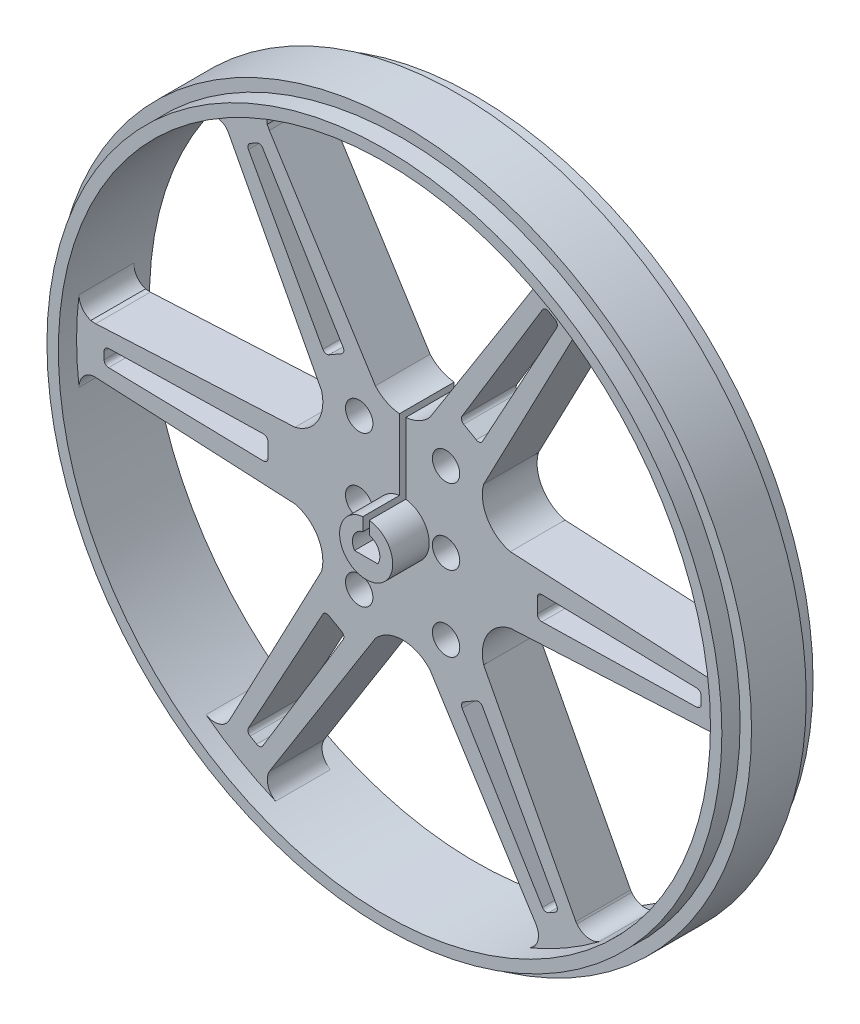
from build123d import *

# Parameters (mm, degrees)
Y_KSEKLIK_EKSTR_ZYON5_DEPTH      = 5
Y_KSEKLIK_EKSTR_ZYON5_DEPTH_BACK = 5
IZIM1_R                          = 37
IZIM1_R_2                        = 35.75
Y_KSEKLIK_EKSTR_ZYON6_DEPTH      = 3
Y_KSEKLIK_EKSTR_ZYON6_DEPTH_BACK = 3
IZIM1_13_R                       = 38.25
IZIM1_13_R_2                     = 37
Y_KSEKLIK_EKSTR_ZYON7_DEPTH      = 3
Y_KSEKLIK_EKSTR_ZYON7_DEPTH_BACK = 3
IZIM1_14_R                       = 1.5
Y_KSEKLIK_EKSTR_ZYON8_DEPTH      = 7
Y_KSEKLIK_EKSTR_ZYON8_DEPTH_BACK = 3


with BuildPart() as part:
    # Çizim1 → Yükseklik-Ekstrüzyon5 (new, two sides: drawn at the far end of the back side and taken through both)
    with BuildSketch(Plane.XY.offset(-Y_KSEKLIK_EKSTR_ZYON5_DEPTH_BACK)):
        Circle(IZIM1_R)
        Circle(IZIM1_R_2, mode=Mode.SUBTRACT)
    extrude(amount=Y_KSEKLIK_EKSTR_ZYON5_DEPTH + Y_KSEKLIK_EKSTR_ZYON5_DEPTH_BACK)

    # Çizim1<13> → Yükseklik-Ekstrüzyon6 (add, two sides: drawn at the far end of the back side and taken through both)
    with BuildSketch(Plane.XY.offset(-Y_KSEKLIK_EKSTR_ZYON6_DEPTH_BACK)):
        Circle(IZIM1_13_R)
        Circle(IZIM1_13_R_2, mode=Mode.SUBTRACT)
    extrude(amount=Y_KSEKLIK_EKSTR_ZYON6_DEPTH + Y_KSEKLIK_EKSTR_ZYON6_DEPTH_BACK)

    # Çizim1<14> → Yükseklik-Ekstrüzyon7 (add, two sides: drawn at the far end of the back side and taken through both)
    with BuildSketch(Plane.XY.offset(-Y_KSEKLIK_EKSTR_ZYON7_DEPTH_BACK)):
        with BuildLine():
            Line((0.352105211, 10.658426892), (0.352105211, 8.25))
            Line((0.352105211, 8.25), (0.352105211, 2.891667151))
            ThreePointArc((0.352105211, 2.891667151), (2.180757714, 1.931324101), (2.913025402, 0))
            ThreePointArc((2.913025402, 0), (-1.931880518, -2.180264813), (-0.350629391, 2.891846473))
            Line((-0.350629391, 2.891846473), (-0.347894744, 8.250178624))
            Line((-0.347894744, 8.250178624), (-0.346665593, 10.658605202))
            ThreePointArc((-0.346665593, 10.658605202), (-1.792646187, 11.069293289), (-2.984941087, 11.98469345))
            Line((-2.984941087, 11.98469345), (-14.607887345, 30.4259885))
            Line((-14.607887345, 30.4259885), (-14.847868654, 30.886461313))
            ThreePointArc((-14.847868654, 30.886461313), (-14.727142284, 32.060689053), (-13.92488883, 32.926584565))
            ThreePointArc((-13.92488883, 32.926584565), (-17.875, 30.960408185), (-21.552814278, 28.522599754))
            ThreePointArc((-21.552814278, 28.522599754), (-20.401800041, 28.78442387), (-19.324525803, 28.301862102))
            Line((-19.324525803, 28.301862102), (-19.045735303, 27.863795787))
            Line((-19.045735303, 27.863795787), (-8.886868167, 8.577081355))
            ThreePointArc((-8.886868167, 8.577081355), (-9.303777514, 5.496482546), (-11.800782256, 3.644761794))
            Line((-11.800782256, 3.644761794), (-33.653555768, 2.549643924))
            Line((-33.653555768, 2.549643924), (-34.19029782, 2.590308308))
            ThreePointArc((-34.19029782, 2.590308308), (-35.134400226, 3.283913251), (-35.477703108, 4.403984811))
            ThreePointArc((-35.477703108, 4.403984811), (-35.75, 0), (-35.477703108, -4.403984811))
            ThreePointArc((-35.477703108, -4.403984811), (-35.134400226, -3.283913251), (-34.19029782, -2.590308308))
            Line((-34.19029782, -2.590308308), (-33.653555768, -2.549643924))
            Line((-33.653555768, -2.549643924), (-11.802585687, -3.638917628))
            ThreePointArc((-11.802585687, -3.638917628), (-9.303458853, -5.492132995), (-8.888309481, -8.575587733))
            Line((-8.888309481, -8.575587733), (-19.045735303, -27.863795787))
            ThreePointArc((-19.045735303, -27.863795787), (-20.165883221, -28.700819486), (-21.552814278, -28.522599754))
            ThreePointArc((-21.552814278, -28.522599754), (-17.875, -30.960408185), (-13.92488883, -32.926584565))
            ThreePointArc((-13.92488883, -32.926584565), (-14.772697173, -31.814576902), (-14.607887345, -30.4259885))
            Line((-14.607887345, -30.4259885), (-2.984941087, -11.98469345))
            ThreePointArc((-2.984941087, -11.98469345), (0.002715908, -10.643228062), (2.991057136, -11.983168513))
            Line((2.991057136, -11.983168513), (14.663708375, -30.397995932))
            ThreePointArc((14.663708375, -30.397995932), (14.817986455, -31.815304786), (13.92488883, -32.926584565))
            ThreePointArc((13.92488883, -32.926584565), (17.875, -30.960408185), (21.552814278, -28.522599754))
            ThreePointArc((21.552814278, -28.522599754), (20.242255546, -28.76161283), (19.107217792, -28.064202809))
            Line((19.107217792, -28.064202809), (18.993975038, -27.89787469))
            Line((18.993975038, -27.89787469), (8.881942007, -8.582182507))
            ThreePointArc((8.881942007, -8.582182507), (9.294710999, -5.488602486), (11.804336715, -3.633233425))
            Line((11.804336715, -3.633233425), (33.657290889, -2.499854))
            Line((33.657290889, -2.499854), (33.849149755, -2.514104082))
            ThreePointArc((33.849149755, -2.514104082), (35.026532395, -3.146147751), (35.477703108, -4.403984811))
            ThreePointArc((35.477703108, -4.403984811), (35.681860841, -2.206197397), (35.75, 0))
            ThreePointArc((35.75, 0), (35.681860841, 2.206197397), (35.477703108, 4.403984811))
            ThreePointArc((35.477703108, 4.403984811), (35.026532395, 3.146147751), (33.849149755, 2.514104082))
            Line((33.849149755, 2.514104082), (33.657290889, 2.499854))
            Line((33.657290889, 2.499854), (11.803877394, 3.634725418))
            ThreePointArc((11.803877394, 3.634725418), (9.295867667, 5.489285508), (8.88302669, 8.581059795))
            Line((8.88302669, 8.581059795), (18.993975038, 27.89787469))
            Line((18.993975038, 27.89787469), (18.993582514, 27.898141932))
            ThreePointArc((18.993582514, 27.898141932), (20.143868947, 28.740405096), (21.552814278, 28.522599754))
            ThreePointArc((21.552814278, 28.522599754), (17.875, 30.960408185), (13.92488883, 32.926584565))
            ThreePointArc((13.92488883, 32.926584565), (14.817986455, 31.815304786), (14.663708375, 30.397995932))
            Line((14.663708375, 30.397995932), (14.663280674, 30.398202247))
            Line((14.663280674, 30.398202247), (2.991057136, 11.983168513))
            ThreePointArc((2.991057136, 11.983168513), (1.798295213, 11.068376963), (0.352105211, 10.658426892))
        make_face()
        with BuildLine():
            ThreePointArc((-15.330091906, -28.374268836), (-15.633406502, -28.599064993), (-16.007432074, -28.547704226))
            Line((-16.007432074, -28.547704226), (-16.719321042, -28.136694938))
            ThreePointArc((-16.719321042, -28.136694938), (-16.950813558, -27.838459675), (-16.907791673, -27.46338345))
            Line((-16.907791673, -27.46338345), (-8.752791972, -12.583042517))
            ThreePointArc((-8.752791972, -12.583042517), (-8.44909878, -12.341848787), (-8.064321341, -12.3903286))
            Line((-8.064321341, -12.3903286), (-6.698178659, -13.179071446))
            ThreePointArc((-6.698178659, -13.179071446), (-6.463805189, -13.488058576), (-6.52083849, -13.87166146))
            Line((-6.52083849, -13.87166146), (-15.330091906, -28.374268836))
        make_face(mode=Mode.SUBTRACT)
        with Locations((-4.7625, -8.25)):
            Circle(IZIM1_14_R, mode=Mode.SUBTRACT)
        with BuildLine():
            Line((16.719321042, -28.136694938), (16.007432074, -28.547704226))
            ThreePointArc((16.007432074, -28.547704226), (15.633406502, -28.599064993), (15.330091906, -28.374268836))
            Line((15.330091906, -28.374268836), (6.52083849, -13.87166146))
            ThreePointArc((6.52083849, -13.87166146), (6.463805189, -13.488058576), (6.698178659, -13.179071446))
            Line((6.698178659, -13.179071446), (8.064321341, -12.3903286))
            ThreePointArc((8.064321341, -12.3903286), (8.44909878, -12.341848787), (8.752791972, -12.583042517))
            Line((8.752791972, -12.583042517), (16.907791673, -27.46338345))
            ThreePointArc((16.907791673, -27.46338345), (16.950813558, -27.838459675), (16.719321042, -28.136694938))
        make_face(mode=Mode.SUBTRACT)
        with Locations((4.7625, -8.25)):
            Circle(IZIM1_14_R, mode=Mode.SUBTRACT)
        with BuildLine():
            Line((-32.726753116, -0.411009288), (-32.726753116, 0.411009288))
            ThreePointArc((-32.726753116, 0.411009288), (-32.584220059, 0.760605318), (-32.237883578, 0.910885385))
            Line((-32.237883578, 0.910885385), (-15.273630462, 1.288618943))
            ThreePointArc((-15.273630462, 1.288618943), (-14.91290397, 1.146209789), (-14.7625, 0.788742846))
            Line((-14.7625, 0.788742846), (-14.7625, -0.788742846))
            ThreePointArc((-14.7625, -0.788742846), (-14.91290397, -1.146209789), (-15.273630462, -1.288618943))
            Line((-15.273630462, -1.288618943), (-32.237883578, -0.910885385))
            ThreePointArc((-32.237883578, -0.910885385), (-32.584220059, -0.760605318), (-32.726753116, -0.411009288))
        make_face(mode=Mode.SUBTRACT)
        with Locations((-4.7625, 0)):
            Circle(IZIM1_14_R, mode=Mode.SUBTRACT)
        with Locations((-4.7625, 8.25)):
            Circle(IZIM1_14_R, mode=Mode.SUBTRACT)
        with BuildLine():
            ThreePointArc((-6.52083849, 13.87166146), (-6.463805189, 13.488058576), (-6.698178659, 13.179071446))
            Line((-6.698178659, 13.179071446), (-8.064321341, 12.3903286))
            ThreePointArc((-8.064321341, 12.3903286), (-8.44909878, 12.341848787), (-8.752791972, 12.583042517))
            Line((-8.752791972, 12.583042517), (-16.907791673, 27.46338345))
            ThreePointArc((-16.907791673, 27.46338345), (-16.950813558, 27.838459675), (-16.719321042, 28.136694938))
            Line((-16.719321042, 28.136694938), (-16.007432074, 28.547704226))
            ThreePointArc((-16.007432074, 28.547704226), (-15.633406502, 28.599064993), (-15.330091906, 28.374268836))
            Line((-15.330091906, 28.374268836), (-6.52083849, 13.87166146))
        make_face(mode=Mode.SUBTRACT)
        with Locations((4.7625, 0)):
            Circle(IZIM1_14_R, mode=Mode.SUBTRACT)
        with Locations((4.7625, 8.25)):
            Circle(IZIM1_14_R, mode=Mode.SUBTRACT)
        with BuildLine():
            ThreePointArc((32.237883578, 0.910885385), (32.584220059, 0.760605318), (32.726753116, 0.411009288))
            Line((32.726753116, 0.411009288), (32.726753116, -0.411009288))
            ThreePointArc((32.726753116, -0.411009288), (32.584220059, -0.760605318), (32.237883578, -0.910885385))
            Line((32.237883578, -0.910885385), (15.273630462, -1.288618943))
            ThreePointArc((15.273630462, -1.288618943), (14.91290397, -1.146209789), (14.7625, -0.788742846))
            Line((14.7625, -0.788742846), (14.7625, 0.788742846))
            ThreePointArc((14.7625, 0.788742846), (14.91290397, 1.146209789), (15.273630462, 1.288618943))
            Line((15.273630462, 1.288618943), (32.237883578, 0.910885385))
        make_face(mode=Mode.SUBTRACT)
        with BuildLine():
            Line((8.064321341, 12.3903286), (6.698178659, 13.179071446))
            ThreePointArc((6.698178659, 13.179071446), (6.463805189, 13.488058576), (6.52083849, 13.87166146))
            Line((6.52083849, 13.87166146), (15.330091906, 28.374268836))
            ThreePointArc((15.330091906, 28.374268836), (15.633406502, 28.599064993), (16.007432074, 28.547704226))
            Line((16.007432074, 28.547704226), (16.719321042, 28.136694938))
            ThreePointArc((16.719321042, 28.136694938), (16.950813558, 27.838459675), (16.907791673, 27.46338345))
            Line((16.907791673, 27.46338345), (8.752791972, 12.583042517))
            ThreePointArc((8.752791972, 12.583042517), (8.44909878, 12.341848787), (8.064321341, 12.3903286))
        make_face(mode=Mode.SUBTRACT)
    extrude(amount=Y_KSEKLIK_EKSTR_ZYON7_DEPTH + Y_KSEKLIK_EKSTR_ZYON7_DEPTH_BACK)

    # Çizim1<17> → Yükseklik-Ekstrüzyon8 (add, two sides: drawn at the far end of the back side and taken through both)
    with BuildSketch(Plane.XY.offset(-Y_KSEKLIK_EKSTR_ZYON8_DEPTH_BACK)):
        with BuildLine():
            ThreePointArc((2.913025402, 0), (2.180757714, 1.931324101), (0.352105211, 2.891667151))
            Line((0.352105211, 2.891667151), (0.352105211, 1.458088447))
            ThreePointArc((0.352105211, 1.458088447), (1.387985779, 0.568766629), (1.274033112, -0.791732044))
            Line((1.274033112, -0.791732044), (-1.274033112, -0.791732044))
            ThreePointArc((-1.274033112, -0.791732044), (-1.387840597, 0.569120792), (-0.351361024, 1.458267956))
            Line((-0.351361024, 1.458267956), (-0.350629391, 2.891846473))
            ThreePointArc((-0.350629391, 2.891846473), (-1.931880518, -2.180264813), (2.913025402, 0))
        make_face()
    extrude(amount=Y_KSEKLIK_EKSTR_ZYON8_DEPTH + Y_KSEKLIK_EKSTR_ZYON8_DEPTH_BACK)


solid = part.part
